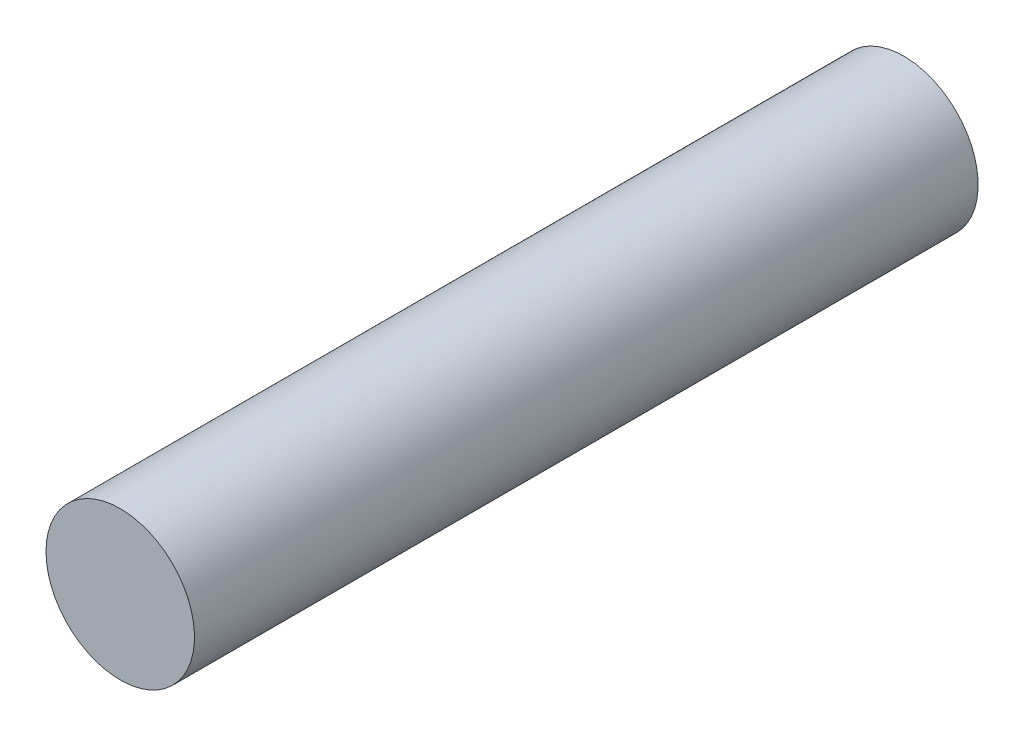
from build123d import *

# Parameters (mm, degrees)
SKETCH1_R           = 90
BOSS_EXTRUDE1_DEPTH = 950


with BuildPart() as part:
    # Sketch1 → Boss-Extrude1 (new body)
    with BuildSketch(Plane.XY):
        with Locations(Location((0, 0, 0), (0, 0, 180))):
            Circle(SKETCH1_R)
    extrude(amount=BOSS_EXTRUDE1_DEPTH)


solid = part.part
